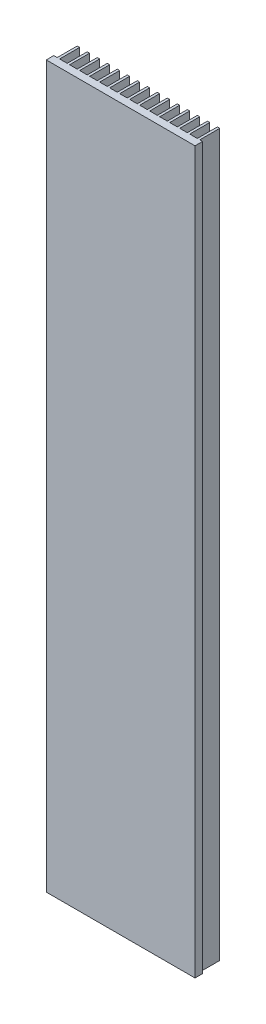
from build123d import *

# Parameters (mm, degrees)
BOSS_EXTRUDE1_DEPTH = 457.2
SKETCH2_W           = 136.525
SKETCH2_H           = 4.7625
CUT_EXTRUDE1_DEPTH  = 479.481428682
SKETCH3_W           = 132.265960651
SKETCH3_H           = 13.462
CUT_EXTRUDE2_DEPTH  = 479.481428682
SKETCH9_OUTSIDE_W   = 234.019
SKETCH9_OUTSIDE_H   = 554.694
SKETCH9_OUTSIDE_W_2 = 94.360380141
SKETCH9_OUTSIDE_H_2 = 481.67440371
CUT_EXTRUDE3_DEPTH  = 478.468171223


with BuildPart() as part:
    # Sketch1 → Boss-Extrude1 (new body)
    with BuildSketch(Plane(origin=(0, 0, 0), x_dir=(1, 0, 0), z_dir=(0, 1, 0))):
        with BuildLine():
            Line((0, 0), (136.525, 0))
            Line((136.525, 0), (136.525, 9.525))
            Line((136.525, 9.525), (132.5372, 9.525))
            Line((132.5372, 9.525), (132.5372, 34.925))
            ThreePointArc((132.5372, 34.925), (131.7752, 35.687), (131.0132, 34.925))
            Line((131.0132, 34.925), (131.0132, 9.525))
            Line((131.0132, 9.525), (126.1872, 9.525))
            Line((126.1872, 9.525), (126.1872, 34.925))
            ThreePointArc((126.1872, 34.925), (125.4252, 35.687), (124.6632, 34.925))
            Line((124.6632, 34.925), (124.6632, 9.525))
            Line((124.6632, 9.525), (119.8372, 9.525))
            Line((119.8372, 9.525), (119.8372, 34.925))
            ThreePointArc((119.8372, 34.925), (119.0752, 35.687), (118.3132, 34.925))
            Line((118.3132, 34.925), (118.3132, 9.525))
            Line((118.3132, 9.525), (113.4872, 9.525))
            Line((113.4872, 9.525), (113.4872, 34.925))
            ThreePointArc((113.4872, 34.925), (112.7252, 35.687), (111.9632, 34.925))
            Line((111.9632, 34.925), (111.9632, 9.525))
            Line((111.9632, 9.525), (107.1372, 9.525))
            Line((107.1372, 9.525), (107.1372, 34.925))
            ThreePointArc((107.1372, 34.925), (106.3752, 35.687), (105.6132, 34.925))
            Line((105.6132, 34.925), (105.6132, 9.525))
            Line((105.6132, 9.525), (100.7872, 9.525))
            Line((100.7872, 9.525), (100.7872, 34.925))
            ThreePointArc((100.7872, 34.925), (100.0252, 35.687), (99.2632, 34.925))
            Line((99.2632, 34.925), (99.2632, 9.525))
            Line((99.2632, 9.525), (94.4372, 9.525))
            Line((94.4372, 9.525), (94.4372, 34.925))
            ThreePointArc((94.4372, 34.925), (93.6752, 35.687), (92.9132, 34.925))
            Line((92.9132, 34.925), (92.9132, 9.525))
            Line((92.9132, 9.525), (88.0872, 9.525))
            Line((88.0872, 9.525), (88.0872, 34.925))
            ThreePointArc((88.0872, 34.925), (87.3252, 35.687), (86.5632, 34.925))
            Line((86.5632, 34.925), (86.5632, 9.525))
            Line((86.5632, 9.525), (81.7372, 9.525))
            Line((81.7372, 9.525), (81.7372, 34.925))
            ThreePointArc((81.7372, 34.925), (80.9752, 35.687), (80.2132, 34.925))
            Line((80.2132, 34.925), (80.2132, 9.525))
            Line((80.2132, 9.525), (75.3872, 9.525))
            Line((75.3872, 9.525), (75.3872, 34.925))
            ThreePointArc((75.3872, 34.925), (74.6252, 35.687), (73.8632, 34.925))
            Line((73.8632, 34.925), (73.8632, 9.525))
            Line((73.8632, 9.525), (69.0372, 9.525))
            Line((69.0372, 9.525), (69.0372, 34.925))
            ThreePointArc((69.0372, 34.925), (68.2752, 35.687), (67.5132, 34.925))
            Line((67.5132, 34.925), (67.5132, 9.525))
            Line((67.5132, 9.525), (62.6872, 9.525))
            Line((62.6872, 9.525), (62.6872, 34.925))
            ThreePointArc((62.6872, 34.925), (61.9252, 35.687), (61.1632, 34.925))
            Line((61.1632, 34.925), (61.1632, 9.525))
            Line((61.1632, 9.525), (56.3372, 9.525))
            Line((56.3372, 9.525), (56.3372, 34.925))
            ThreePointArc((56.3372, 34.925), (55.5752, 35.687), (54.8132, 34.925))
            Line((54.8132, 34.925), (54.8132, 9.525))
            Line((54.8132, 9.525), (49.9872, 9.525))
            Line((49.9872, 9.525), (49.9872, 34.925))
            ThreePointArc((49.9872, 34.925), (49.2252, 35.687), (48.4632, 34.925))
            Line((48.4632, 34.925), (48.4632, 9.525))
            Line((48.4632, 9.525), (43.6372, 9.525))
            Line((43.6372, 9.525), (43.6372, 34.925))
            ThreePointArc((43.6372, 34.925), (42.8752, 35.687), (42.1132, 34.925))
            Line((42.1132, 34.925), (42.1132, 9.525))
            Line((42.1132, 9.525), (37.2872, 9.525))
            Line((37.2872, 9.525), (37.2872, 34.925))
            ThreePointArc((37.2872, 34.925), (36.5252, 35.687), (35.7632, 34.925))
            Line((35.7632, 34.925), (35.7632, 9.525))
            Line((35.7632, 9.525), (30.9372, 9.525))
            Line((30.9372, 9.525), (30.9372, 34.925))
            ThreePointArc((30.9372, 34.925), (30.1752, 35.687), (29.4132, 34.925))
            Line((29.4132, 34.925), (29.4132, 9.525))
            Line((29.4132, 9.525), (24.5872, 9.525))
            Line((24.5872, 9.525), (24.5872, 34.925))
            ThreePointArc((24.5872, 34.925), (23.8252, 35.687), (23.0632, 34.925))
            Line((23.0632, 34.925), (23.0632, 9.525))
            Line((23.0632, 9.525), (18.2372, 9.525))
            Line((18.2372, 9.525), (18.2372, 34.925))
            ThreePointArc((18.2372, 34.925), (17.4752, 35.687), (16.7132, 34.925))
            Line((16.7132, 34.925), (16.7132, 9.525))
            Line((16.7132, 9.525), (11.8872, 9.525))
            Line((11.8872, 9.525), (11.8872, 34.925))
            ThreePointArc((11.8872, 34.925), (11.1252, 35.687), (10.3632, 34.925))
            Line((10.3632, 34.925), (10.3632, 9.525))
            Line((10.3632, 9.525), (5.5372, 9.525))
            Line((5.5372, 9.525), (5.5372, 34.925))
            ThreePointArc((5.5372, 34.925), (4.7752, 35.687), (4.0132, 34.925))
            Line((4.0132, 34.925), (4.0132, 9.525))
            Line((4.0132, 9.525), (0, 9.525))
            Line((0, 9.525), (0, 0))
        make_face()
    extrude(amount=BOSS_EXTRUDE1_DEPTH)

    # Sketch2 → Cut-Extrude1 (cut, through all)
    with BuildSketch(Plane(origin=(0, 457.2, 0), x_dir=(1, 0, 0), z_dir=(0, 1, 0))):
        with Locations((68.2625, 2.38125)):
            Rectangle(SKETCH2_W, SKETCH2_H)
    extrude(amount=-CUT_EXTRUDE1_DEPTH, mode=Mode.SUBTRACT)

    # Sketch3 → Cut-Extrude2 (cut, through all)
    with BuildSketch(Plane.XZ):
        with Locations((69.2831702, -28.956)):
            Rectangle(SKETCH3_W, SKETCH3_H)
    extrude(amount=-CUT_EXTRUDE2_DEPTH, mode=Mode.SUBTRACT)

    # Sketch9 outside → Cut-Extrude3 (cut, through all)
    with BuildSketch(Plane.XY.offset(-4.7625)):
        with Locations((68.2625, 228.6)):
            Rectangle(SKETCH9_OUTSIDE_W, SKETCH9_OUTSIDE_H)
        with Locations((68.07230993, 238.432707494)):
            Rectangle(SKETCH9_OUTSIDE_W_2, SKETCH9_OUTSIDE_H_2, mode=Mode.SUBTRACT)
    extrude(amount=-CUT_EXTRUDE3_DEPTH, mode=Mode.SUBTRACT)


solid = part.part
